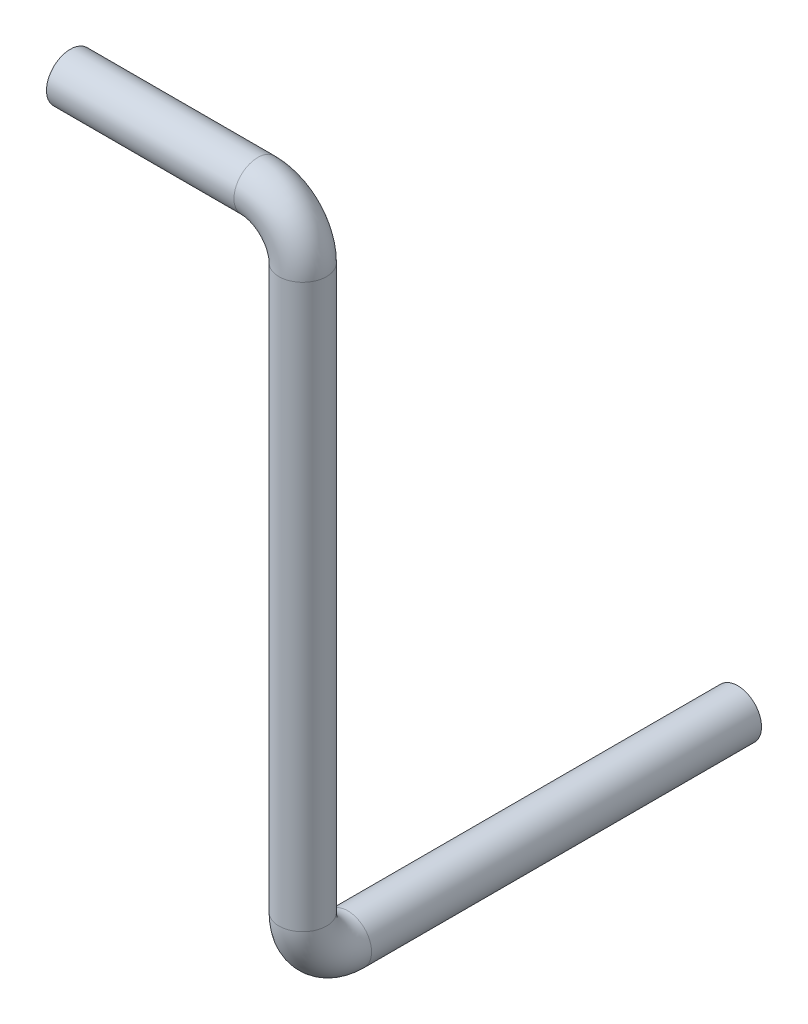
from build123d import *

# Parameters (mm, degrees)
TUBE_PROFILE_R   = 3.175
TUBE_PROFILE_R_2 = 2.175


with BuildPart() as part:
    # Tube: sweep along a curve in space
    with BuildLine() as tube_path:
        Line((154, 167, 70), (179, 167, 70))
        ThreePointArc((185, 161, 70), (183.242640687, 165.242640687, 70), (179, 167, 70))
        Line((185, 161, 70), (185, 86, 70))
        ThreePointArc((185, 80, 64), (185, 81.757359313, 68.242640687), (185, 86, 70))
        Line((185, 80, 64), (185, 80, 12))
    # Tube profile (on start of the path) → Tube (sweep)
    with BuildSketch(Plane(origin=(154, 167, 70), x_dir=(0, 0, 1), z_dir=(1, 0, 0))):
        Circle(TUBE_PROFILE_R)
        Circle(TUBE_PROFILE_R_2, mode=Mode.SUBTRACT)
    sweep(path=tube_path.line)


solid = part.part
